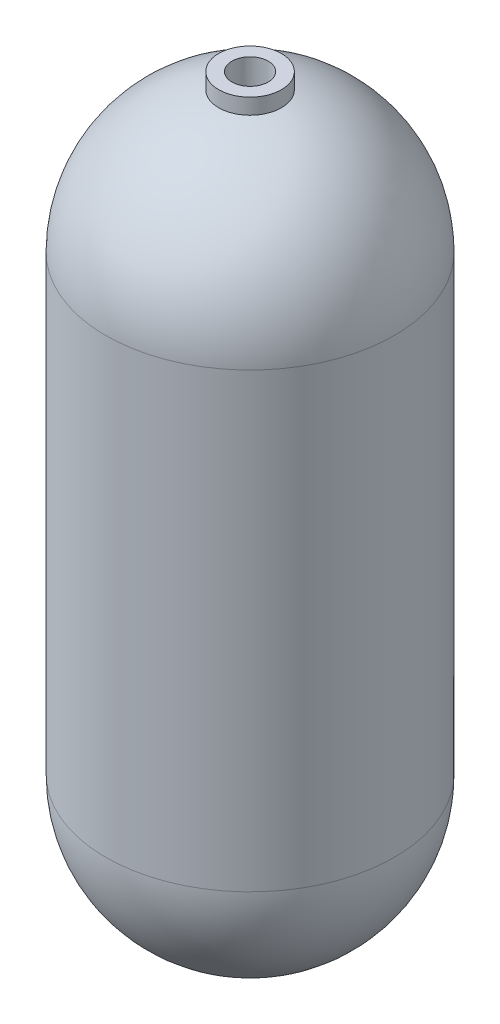
from build123d import *

# Parameters (mm, degrees)
F_5_8_18_TAPPED_HOLE2_D     = 14.68374
F_5_8_18_TAPPED_HOLE2_DEPTH = 38.862
F_5_8_18_TAPPED_HOLE2_TIP   = 4.411440553


with BuildPart() as part:
    # Sketch4 → Revolve1 (revolve)
    with BuildSketch(Plane.XY):
        with BuildLine():
            Line((12.7, 63.372858574), (12.7, 57.022858574))
            ThreePointArc((12.7, 57.022858574), (45.57867045, 36.544236208), (58.42, 0))
            Line((58.42, 0), (58.42, -183.007141426))
            ThreePointArc((58.42, -183.007141426), (41.309178157, -224.316319582), (0, -241.427141426))
            Line((0, -241.427141426), (0, -235.077141426))
            ThreePointArc((0, -235.077141426), (36.819050096, -219.826191522), (52.07, -183.007141426))
            Line((52.07, -183.007141426), (52.07, 0))
            ThreePointArc((52.07, 0), (38.999547433, 34.501017376), (6.35, 51.681354471))
            ThreePointArc((6.35, 51.681354471), (4.447999693, 51.87967038), (2.54, 52.008011883))
            Line((2.54, 52.008011883), (2.54, 63.372858574))
            Line((2.54, 63.372858574), (6.35, 63.372858574))
            Line((6.35, 63.372858574), (12.7, 63.372858574))
        make_face()
    revolve(axis=Axis((0, 80.447885323, 0), (0, -1, 0)))

    # 5/8-18 Tapped Hole2
    with Locations(Plane(origin=(0, 63.372858574, 0), x_dir=(1, 0, 0), z_dir=(0, 1, 0))):
        with Locations((0, 0)):
            Hole(F_5_8_18_TAPPED_HOLE2_D / 2, depth=F_5_8_18_TAPPED_HOLE2_DEPTH)
            with Locations((0, 0, -(F_5_8_18_TAPPED_HOLE2_DEPTH + F_5_8_18_TAPPED_HOLE2_TIP / 2))):  # 118° drill point
                Cone(0, F_5_8_18_TAPPED_HOLE2_D / 2, F_5_8_18_TAPPED_HOLE2_TIP, mode=Mode.SUBTRACT)


solid = part.part
